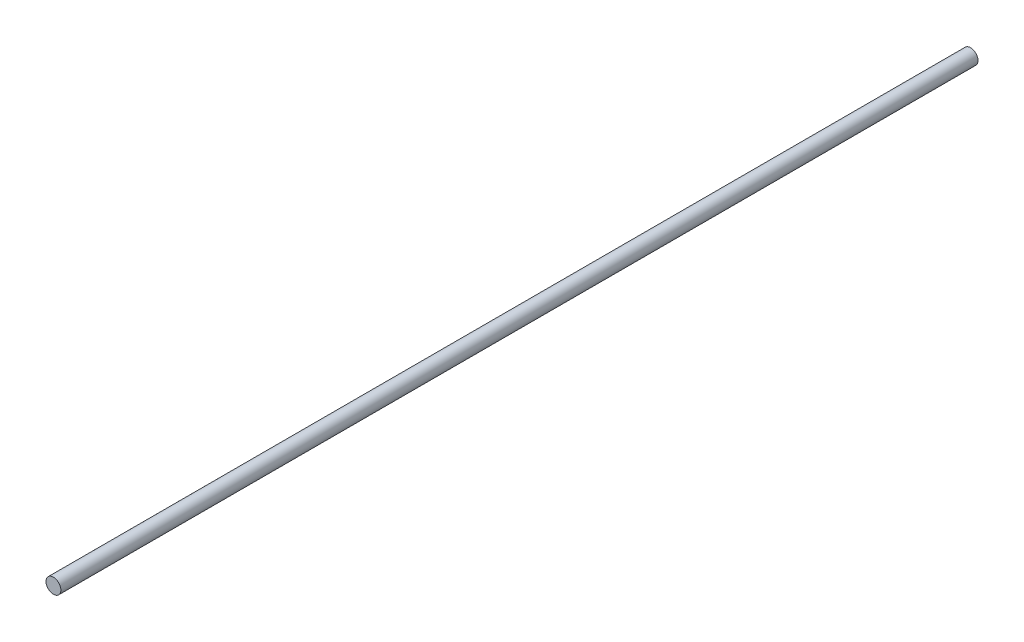
from build123d import *

# Parameters (mm, degrees)
SKETCH1_R           = 3
BOSS_EXTRUDE1_DEPTH = 370


with BuildPart() as part:
    # Sketch1 → Boss-Extrude1 (new body)
    with BuildSketch(Plane.XY):
        with Locations((-32.409477345, 8.431733943)):
            Circle(SKETCH1_R)
    extrude(amount=BOSS_EXTRUDE1_DEPTH)


solid = part.part
